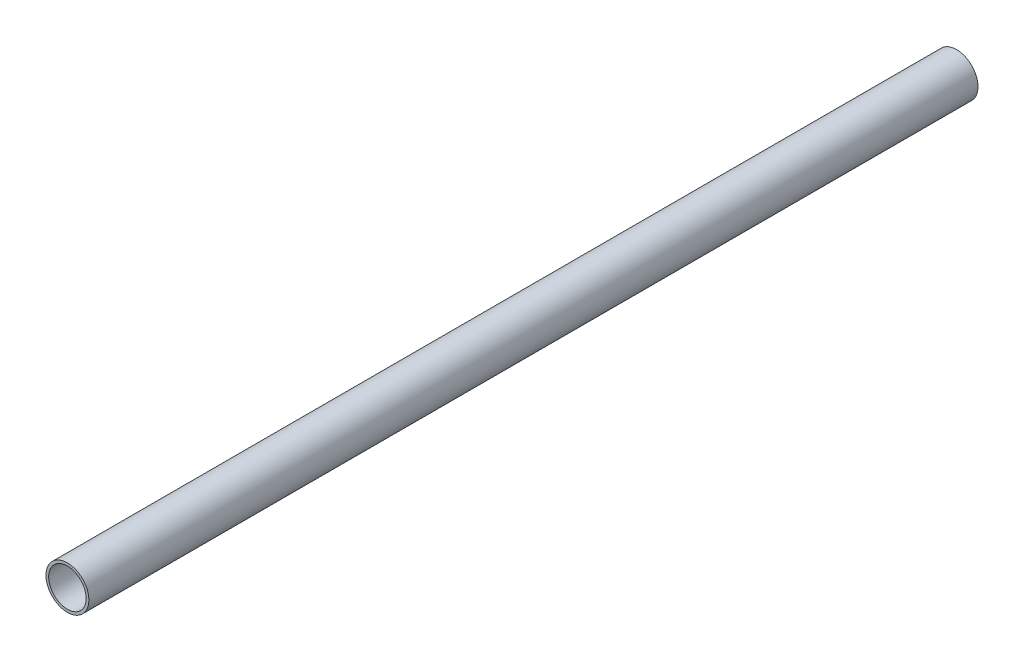
from build123d import *

# Parameters (mm, degrees)
SKETCH2_R           = 24.125
SKETCH2_R_2         = 21.075
BOSS_EXTRUDE1_DEPTH = 1000


with BuildPart() as part:
    # Sketch2 → Boss-Extrude1 (new body)
    with BuildSketch(Plane.XY):
        with Locations((2449.72011288, -5187.007415734)):
            Circle(SKETCH2_R)
        with Locations((2449.72011288, -5187.007415734)):
            Circle(SKETCH2_R_2, mode=Mode.SUBTRACT)
    extrude(amount=BOSS_EXTRUDE1_DEPTH)


solid = part.part
